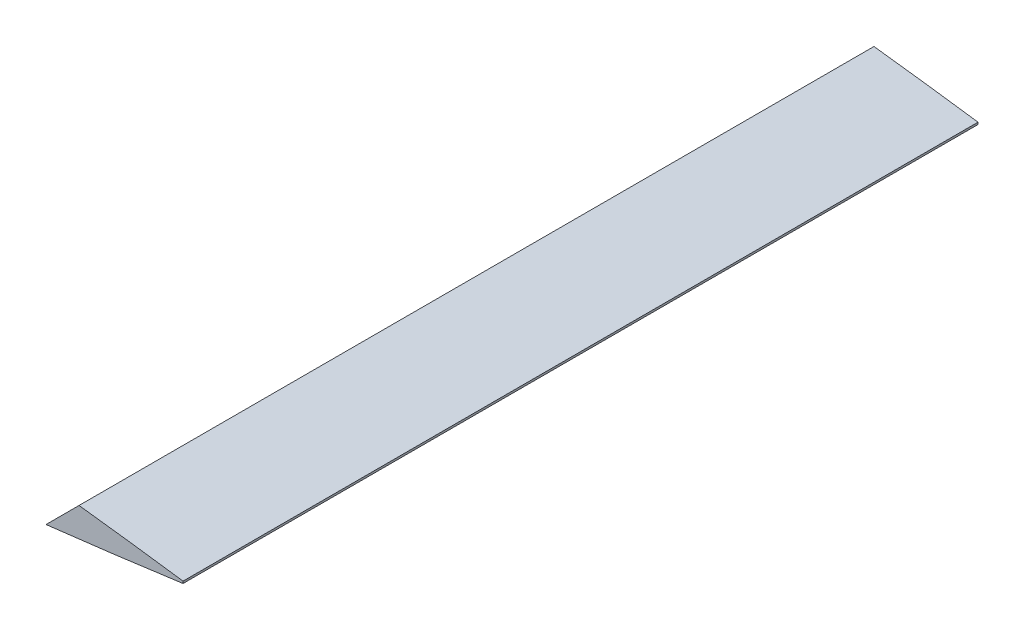
from build123d import *

# Parameters (mm, degrees)
BOSS_EXTRUDE1_DEPTH     = 290
CUT_EXTRUDE8_DEPTH      = 20
CUT_EXTRUDE8_DEPTH_BACK = 20
SKETCH8_OUTSIDE_W       = 385.76
SKETCH8_OUTSIDE_H       = 375.76
SKETCH8_OUTSIDE_W_2     = 50
SKETCH8_OUTSIDE_H_2     = 290
CUT_EXTRUDE9_DEPTH      = 300


with BuildPart() as part:
    # Sketch5 → Boss-Extrude1 (new body)
    with BuildSketch(Plane.XY):
        with BuildLine():
            Line((300, 0.378), (300, -0.378))
            add(Edge.make_bspline(
                [(300, 0.378), (299.270406424, 0.479445822), (297.234667094, 0.762503754), (293.659650161, 1.257673506), (289.112411795, 1.874242443), (284.080816659, 2.54451744), (278.752044218, 3.238122316), (273.265899022, 3.934946436), (267.705955472, 4.629019943), (262.11456302, 5.313069107), (256.508348909, 5.982191812), (250.891738994, 6.637990809), (245.269556965, 7.281779235), (239.647345349, 7.912232764), (234.025130107, 8.526992046), (228.399087903, 9.126229764), (222.768257645, 9.713077606), (217.135920793, 10.28745981), (211.505410154, 10.846941084), (205.877619803, 11.391642827), (200.251512374, 11.920884624), (194.626420536, 12.434617078), (189.002797137, 12.931911809), (183.381530938, 13.413097581), (177.763225616, 13.876376701), (172.148301533, 14.321237194), (166.537529462, 14.747820918), (160.931736194, 15.154228144), (155.33170885, 15.539100856), (149.737538345, 15.902649564), (144.148688279, 16.241846119), (138.565679604, 16.557420546), (132.990859803, 16.847397555), (127.42743944, 17.110211679), (121.877619637, 17.343891718), (116.340758577, 17.545256813), (110.815476382, 17.71267912), (105.301273398, 17.844497938), (99.800570116, 17.940091813), (94.317435844, 17.996590439), (88.855764067, 18.010124458), (83.418647975, 17.97923384), (78.008480827, 17.899160713), (72.628455365, 17.767033787), (67.282738746, 17.579413934), (61.977364895, 17.331515489), (56.720691016, 17.021032651), (51.525175322, 16.64095807), (46.408202619, 16.190188591), (41.394176065, 15.661669099), (36.515671087, 15.053963784), (31.819009441, 14.365623605), (27.366164829, 13.603475684), (23.235217954, 12.782583444), (19.502642451, 11.920250751), (16.218271393, 11.044597796), (13.389186016, 10.175076255), (10.984929333, 9.333498715), (8.961561478, 8.522062882), (7.267292053, 7.746976002), (5.846052466, 7.010625622), (4.647711085, 6.300634033), (3.628235251, 5.606513668), (2.751909197, 4.926635252), (2.00625736, 4.249917259), (1.390586137, 3.570259492), (0.901000435, 2.890942252), (0.529275535, 2.220219273), (0.260479537, 1.566458936), (0.085712654, 0.931035928), (-0.003509247, 0.308981015), (-0.003509247, -0.308981015), (0.085712654, -0.931035928), (0.260479537, -1.566458936), (0.529275535, -2.220219273), (0.901000435, -2.890942252), (1.390586137, -3.570259492), (2.00625736, -4.249917259), (2.751909197, -4.926635252), (3.628235251, -5.606513668), (4.647711085, -6.300634033), (5.846052466, -7.010625622), (7.267292053, -7.746975999), (8.961561475, -8.522062895), (10.984929344, -9.333498651), (13.389185965, -10.175076559), (16.21827163, -11.044596377), (19.502641361, -11.92025728), (23.235222799, -12.782554413), (27.366127559, -13.603596161), (31.819075008, -14.365113363), (36.515634637, -15.054106097), (41.394182204, -15.661628887), (46.408200924, -16.190199694), (51.525175786, -16.640955027), (56.720690889, -17.02103348), (61.977364929, -17.331515263), (67.282738736, -17.579413995), (72.628455367, -17.767033771), (78.008480826, -17.899160717), (83.418647975, -17.979233839), (88.855764067, -18.010124458), (94.317435844, -17.996590438), (99.800570116, -17.940091813), (105.301273398, -17.844497938), (110.815476382, -17.71267912), (116.340758577, -17.545256813), (121.877619637, -17.343891718), (127.42743944, -17.110211679), (132.990859803, -16.847397555), (138.565679604, -16.557420546), (144.148688279, -16.241846119), (149.737538345, -15.902649564), (155.33170885, -15.539100856), (160.931736194, -15.154228144), (166.537529462, -14.747820918), (172.148301533, -14.321237194), (177.763225616, -13.876376701), (183.381530938, -13.413097581), (189.002797137, -12.931911809), (194.626420536, -12.434617078), (200.251512374, -11.920884624), (205.877619803, -11.391642827), (211.505410154, -10.846941084), (217.135920793, -10.28745981), (222.768257645, -9.713077606), (228.399087903, -9.126229764), (234.025130107, -8.526992046), (239.647345349, -7.912232764), (245.269556965, -7.281779235), (250.891738994, -6.637990809), (256.508348909, -5.982191812), (262.11456302, -5.313069107), (267.705955472, -4.629019943), (273.265899022, -3.934946436), (278.752044218, -3.238122316), (284.080816659, -2.54451744), (289.112411795, -1.874242443), (293.659650161, -1.257673506), (297.234667094, -0.762503754), (299.270406424, -0.479445822), (300, -0.378)],
                knots=[0, 0, 0, 0, 0.003612221, 0.010078953, 0.017698618, 0.026115111, 0.034970966, 0.04405038, 0.05323433, 0.06244757, 0.071673993, 0.080921319, 0.090177538, 0.099424342, 0.108664441, 0.117912199, 0.127169502, 0.136426595, 0.145675426, 0.154916495, 0.164153237, 0.173386649, 0.182615736, 0.191838089, 0.201053134, 0.210260393, 0.219458942, 0.228646747, 0.237822316, 0.246985224, 0.256137384, 0.265279416, 0.27440695, 0.283512193, 0.292591781, 0.301646285, 0.310681793, 0.319699068, 0.32869452, 0.33766016, 0.346588583, 0.355477412, 0.364322937, 0.373121614, 0.381867635, 0.390553005, 0.399166026, 0.407689628, 0.416098119, 0.424354887, 0.432412429, 0.440204728, 0.447630505, 0.454563638, 0.460855379, 0.466413319, 0.47122861, 0.475365774, 0.47890126, 0.481915077, 0.484498872, 0.486747127, 0.488741252, 0.490543179, 0.492182104, 0.493672831, 0.495031908, 0.49627906, 0.497424737, 0.498490166, 0.499502758, 0.500497254, 0.501509846, 0.502575275, 0.503720952, 0.504968104, 0.506327181, 0.507817908, 0.509456832, 0.51125876, 0.513252884, 0.51550114, 0.518084934, 0.521098752, 0.524634237, 0.528771401, 0.533586692, 0.539144632, 0.545436374, 0.552369506, 0.5597952, 0.567587571, 0.575645113, 0.583901881, 0.592310372, 0.600833974, 0.609446995, 0.618132365, 0.626878386, 0.635677063, 0.644522588, 0.653411417, 0.66233984, 0.67130548, 0.680300932, 0.689318207, 0.698353715, 0.707408219, 0.716487807, 0.72559305, 0.734720584, 0.743862616, 0.753014776, 0.762177684, 0.771353253, 0.780541058, 0.789739607, 0.798946866, 0.808161911, 0.817384264, 0.826613351, 0.835846763, 0.845083505, 0.854324574, 0.863573405, 0.872830498, 0.882087801, 0.891335559, 0.900575658, 0.909822462, 0.919078681, 0.928326007, 0.93755243, 0.94676567, 0.95594962, 0.965029034, 0.973884889, 0.982301382, 0.989921047, 0.996387779, 1, 1, 1, 1], degree=3))
        make_face()
    extrude(amount=BOSS_EXTRUDE1_DEPTH)

    # Sketch8 outside → Cut-Extrude8 (cut, two sides: drawn at the far end of the back side and taken through both)
    with BuildSketch(Plane(origin=(0, 0, 0), x_dir=(1, 0, 0), z_dir=(0, 1, 0)).offset(-CUT_EXTRUDE8_DEPTH_BACK)):
        with Locations((150, -145)):
            Rectangle(SKETCH8_OUTSIDE_W, SKETCH8_OUTSIDE_H)
        with Locations((275, -145)):
            Rectangle(SKETCH8_OUTSIDE_W_2, SKETCH8_OUTSIDE_H_2, mode=Mode.SUBTRACT)
    extrude(amount=CUT_EXTRUDE8_DEPTH + CUT_EXTRUDE8_DEPTH_BACK, mode=Mode.SUBTRACT)

    # Sketch9 → Cut-Extrude9 (cut)
    with BuildSketch(Plane.XY):
        Polygon((250, -6.738836522), (280, 23.261163478), (250, 23.261163478), align=None)
    extrude(amount=CUT_EXTRUDE9_DEPTH, mode=Mode.SUBTRACT)


solid = part.part
